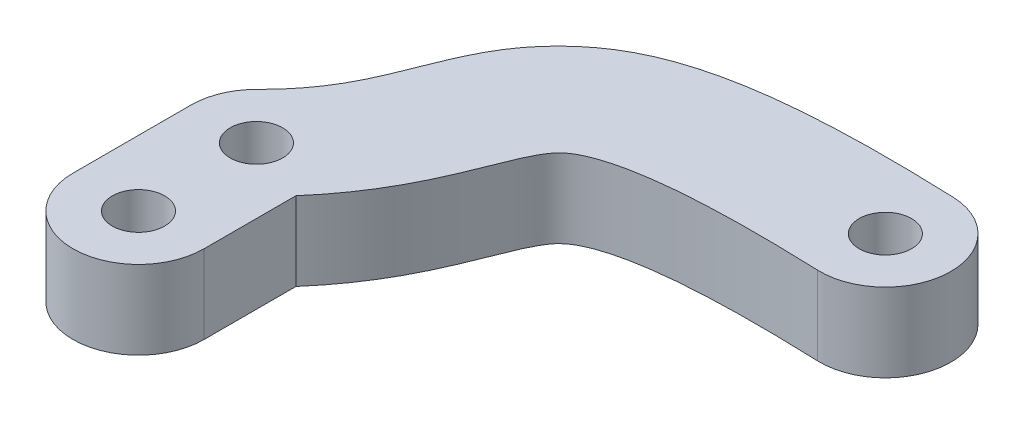
from build123d import *

# Parameters (mm, degrees)
BOSS_EXTRUDE1_DEPTH = 3
SKETCH2_R           = 1
CUT_EXTRUDE1_DEPTH  = 22.181959729


with BuildPart() as part:
    # Sketch1 → Boss-Extrude1 (new body)
    with BuildSketch(Plane(origin=(0, 0, 0), x_dir=(1, 0, 0), z_dir=(0, 1, 0))):
        with BuildLine():
            Line((2.5, 0), (2.5, -4.5))
            ThreePointArc((2.5, -4.5), (0, -7), (-2.5, -4.5))
            Line((-2.5, -4.5), (-2.5, 0))
            ThreePointArc((-2.5, 0), (0, 2.5), (2.5, 0))
        make_face()
        with BuildLine():
            ThreePointArc((1.75437082, -1.781062331), (-1.781062331, -1.75437082), (-1.75437082, 1.781062331))
            add(Edge.make_bspline(
                [(-1.75437082, 1.781062331), (-1.624344078, 1.909140455), (-1.363618783, 2.180920031), (-0.934031434, 2.684894066), (-0.500467654, 3.293174505), (-0.101558497, 3.999057838), (0.34080487, 4.957895832), (0.821917137, 6.255571477), (1.714343148, 8.188128347), (3.655881762, 10.080915103), (5.933377524, 10.940861788), (8.146541971, 11.336521676), (10.080084472, 11.509987641), (11.978583924, 11.559465158), (13.677207867, 11.543719259), (14.630887101, 11.515746346), (15.094478117, 11.498214139)],
                knots=[0, 0, 0, 0, 0.03125, 0.0625, 0.125, 0.1875, 0.25, 0.375, 0.5, 0.625, 0.75, 0.8125, 0.875, 0.9375, 0.96875, 1, 1, 1, 1], degree=3))
            ThreePointArc((15.094478117, 11.498214139), (17.498214139, 8.905521883), (14.905521883, 6.501785861))
            add(Edge.make_bspline(
                [(1.75437082, -1.781062331), (1.951496972, -1.586890368), (2.342143686, -1.179754933), (3.020330121, -0.385545775), (3.725845298, 0.603727778), (4.363656227, 1.735460048), (4.994886909, 3.116947346), (5.504379808, 4.503589215), (5.878706331, 5.199246763), (6.125781999, 5.475918673), (6.372815317, 5.672288553), (6.830218188, 5.908335694), (7.611720621, 6.156671842), (8.771844258, 6.369671634), (10.080276197, 6.489545456), (11.343932269, 6.540793236), (12.408742942, 6.555070021), (13.575038588, 6.544467964), (14.472115696, 6.51817653), (14.905521883, 6.501785861)],
                knots=[0, 0, 0, 0, 0.03125, 0.0625, 0.125, 0.1875, 0.25, 0.375, 0.5, 0.5625, 0.625, 0.6875, 0.75, 0.8125, 0.875, 0.90625, 0.9375, 0.96875, 1, 1, 1, 1], degree=3))
        make_face()
    extrude(amount=BOSS_EXTRUDE1_DEPTH)

    # Sketch2 → Cut-Extrude1 (cut, through all)
    with BuildSketch(Plane(origin=(0, 3, 0), x_dir=(1, 0, 0), z_dir=(0, 1, 0))):
        with Locations(Location((0, 0, 0), (0, 0, 270))):
            Circle(SKETCH2_R)
        with Locations(Location((0, -4.5, 0), (0, 0, 270))):
            Circle(SKETCH2_R)
        with Locations(Location((15, 9, 0), (0, 0, 270))):
            Circle(SKETCH2_R)
    extrude(amount=-CUT_EXTRUDE1_DEPTH, mode=Mode.SUBTRACT)


solid = part.part
